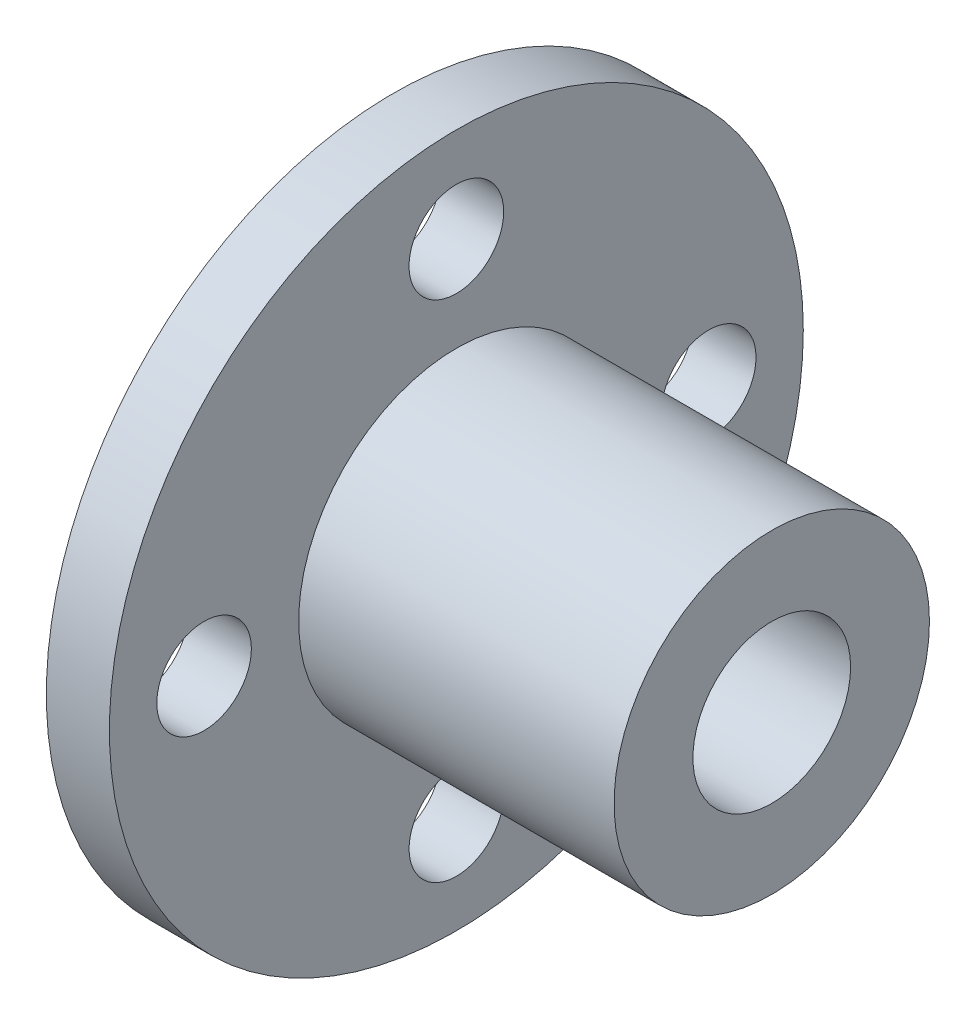
from build123d import *

# Parameters (mm, degrees)
SKETCH_1_R          = 11
EXTRUDE_1_DEPTH     = 2
SKETCH_2_R          = 5
SKETCH_2_R_2        = 2.5
EXTRUDE_2_DEPTH     = 10
SKETCH_3_R          = 1.5
CUT_EXTRUDE_1_DEPTH = 10
SKETCH_5_R          = 2.5
CUT_EXTRUDE_2_DEPTH = 19.493242009


with BuildPart() as part:
    # 草图1 → 凸台-拉伸1 (new body)
    with BuildSketch(Plane(origin=(0, 0, 0), x_dir=(0, 0, -1), z_dir=(1, 0, 0))):
        Circle(SKETCH_1_R)
    extrude(amount=EXTRUDE_1_DEPTH)

    # 草图2 → 凸台-拉伸2 (add)
    with BuildSketch(Plane(origin=(2, 0, 0), x_dir=(0, 0, -1), z_dir=(1, 0, 0))):
        Circle(SKETCH_2_R)
        Circle(SKETCH_2_R_2, mode=Mode.SUBTRACT)
    extrude(amount=EXTRUDE_2_DEPTH)

    # 草图3 → 切除-拉伸1 (cut)
    with BuildSketch(Plane(origin=(2, 0, 0), x_dir=(0, 0, -1), z_dir=(1, 0, 0))):
        with Locations((0, 8)):
            Circle(SKETCH_3_R)
        with Locations((8.001, 0.001)):
            Circle(SKETCH_3_R)
        with Locations((0.002, -8)):
            Circle(SKETCH_3_R)
        with Locations((-7.999, -0.001)):
            Circle(SKETCH_3_R)
    extrude(amount=-CUT_EXTRUDE_1_DEPTH, mode=Mode.SUBTRACT)

    # 草图5 → 切除-拉伸2 (cut, through all)
    with BuildSketch(Plane(origin=(2, 0, 0), x_dir=(0, 0, -1), z_dir=(1, 0, 0))):
        Circle(SKETCH_5_R)
    extrude(amount=-CUT_EXTRUDE_2_DEPTH, mode=Mode.SUBTRACT)


solid = part.part
